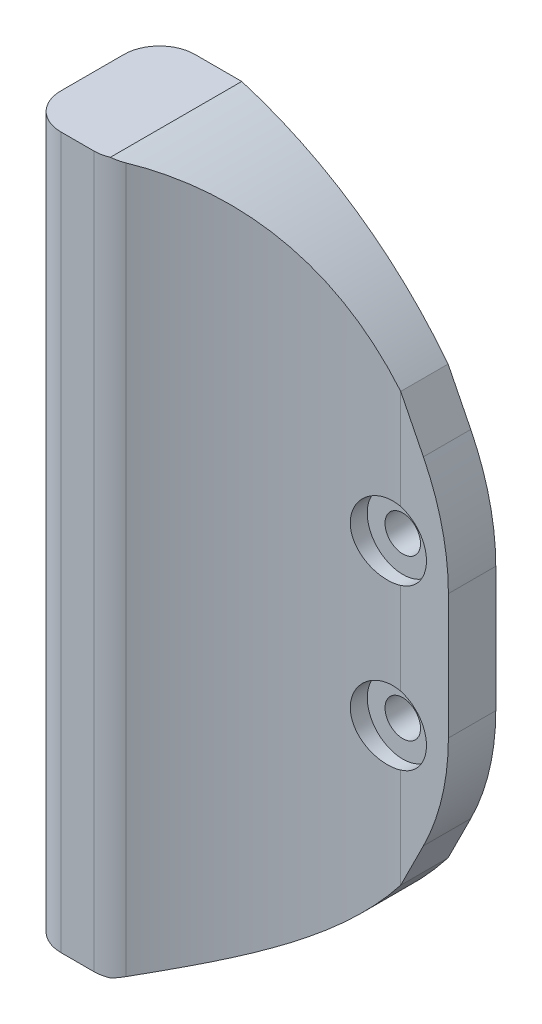
from build123d import *

# Parameters (mm, degrees)
SKETCH_1_W          = 35.317292642
SKETCH_1_H          = 60
SKETCH_1_R          = 1.5
EXTRUDE_1_DEPTH     = 8
SKETCH_2_R          = 3
CUT_EXTRUDE_1_DEPTH = 3
EXTRUDE_2_DEPTH     = 60
FILLET_1_R          = 3
SKETCH_4_R          = 5
CUT_EXTRUDE_2_DEPTH = 47.960729747
CUT_EXTRUDE_3_DEPTH = 10
FILLET_2_R          = 20
CUT_EXTRUDE_4_DEPTH = 71.495063746
CUT_EXTRUDE_5_DEPTH = 2
CUT_EXTRUDE_6_DEPTH = 48.639836404
CUT_EXTRUDE_7_DEPTH = 71.495063746
FILLET_4_R          = 3


with BuildPart() as part:
    # 草图1 → 凸台-拉伸1 (new body)
    with BuildSketch(Plane.XY):
        Rectangle(SKETCH_1_W, SKETCH_1_H)
        with Locations((0, 13.5)):
            Circle(SKETCH_1_R, mode=Mode.SUBTRACT)
        with Locations((11.691342951, 6.75)):
            Circle(SKETCH_1_R, mode=Mode.SUBTRACT)
        with Locations((11.691342951, -6.75)):
            Circle(SKETCH_1_R, mode=Mode.SUBTRACT)
        with Locations((0, -13.5)):
            Circle(SKETCH_1_R, mode=Mode.SUBTRACT)
        with Locations((-11.691342951, -6.75)):
            Circle(SKETCH_1_R, mode=Mode.SUBTRACT)
        with Locations((-11.691342951, 6.75)):
            Circle(SKETCH_1_R, mode=Mode.SUBTRACT)
    extrude(amount=EXTRUDE_1_DEPTH)

    # 草图2 → 切除-拉伸1 (cut)
    with BuildSketch(Plane.XY.offset(8)):
        with Locations((0, 13.5)):
            Circle(SKETCH_2_R)
        with Locations((11.691342951, 6.75)):
            Circle(SKETCH_2_R)
        with Locations((11.691342951, -6.75)):
            Circle(SKETCH_2_R)
        with Locations((0, -13.5)):
            Circle(SKETCH_2_R)
        with Locations((-11.691342951, -6.75)):
            Circle(SKETCH_2_R)
        with Locations((-11.691342951, 6.75)):
            Circle(SKETCH_2_R)
    extrude(amount=-CUT_EXTRUDE_1_DEPTH, mode=Mode.SUBTRACT)

    # 草图3 → 凸台-拉伸2 (add)
    with BuildSketch(Plane.XZ.offset(30)):
        Polygon((-23.303511793, 11.324481191), (-17.658646321, 8), (-17.658646321, 0), (-35.232231527, 0), (-35.232231527, 11.324481191), align=None)
    extrude(amount=-EXTRUDE_2_DEPTH)

    # 圆角1
    fillet_1_edges = [part.edges().sort_by_distance(p)[0] for p in [
        (-17.658646321, 0, 8),
        (-35.232231527, 0, 11.324481191),
        (17.658646321, -30, 4),
        (-35.232231527, 0, 0),
        (-23.303511793, 0, 11.324481191),
        (17.658646321, 30, 4),
    ]]
    fillet(fillet_1_edges, radius=FILLET_1_R)

    # 草图4 → 切除-拉伸2 (cut, through all)
    with BuildSketch(Plane.XY.offset(8)):
        Circle(SKETCH_4_R)
    extrude(amount=-CUT_EXTRUDE_2_DEPTH, mode=Mode.SUBTRACT)

    # 草图5 → 切除-拉伸3 (cut)
    with BuildSketch(Plane.XY.offset(8)):
        with BuildLine():
            ThreePointArc((14.658646321, -30), (16.779966665, -29.121320344), (17.658646321, -27))
            Line((17.658646321, -27), (17.658646321, 27))
            ThreePointArc((17.658646321, 27), (16.779966665, 29.121320344), (14.658646321, 30))
            Line((14.658646321, 30), (-16.840879336, 30))
            Line((-16.840879336, 30), (-6.840879336, 10))
            Line((-6.840879336, 10), (-6.840879336, 0))
            Line((-6.840879336, 0), (-6.840879336, -10))
            Line((-6.840879336, -10), (-16.840879336, -30))
            Line((-16.840879336, -30), (14.658646321, -30))
        make_face()
    extrude(amount=-CUT_EXTRUDE_3_DEPTH, mode=Mode.SUBTRACT)

    # 圆角2
    fillet_2_edges = [part.edges().sort_by_distance(p)[0] for p in [
        (-6.840879336, -10, 4),
        (-6.840879336, 10, 4),
    ]]
    fillet(fillet_2_edges, radius=FILLET_2_R)

    # 草图6 → 切除-拉伸4 (cut, through all)
    with BuildSketch(Plane.XZ.offset(30)):
        with BuildLine():
            Line((-18.363290882, 8.414992633), (-16.840879336, 7.518385164))
            Line((-16.840879336, 7.518385164), (-16.840879336, 8))
            ThreePointArc((-16.840879336, 8), (-17.629859025, 8.105606963), (-18.363290882, 8.414992633))
        make_face()
        Polygon((-16.840879336, 8), (-16.840879336, 7.518385164), (-10.866770961, 4), (-6.840879336, 4), (-6.840879336, 8), (-8.952335516, 8), align=None)
        with BuildLine():
            Line((-28.285671321, 11.324481191), (-16.840879336, 6.512055498))
            Line((-16.840879336, 6.512055498), (-16.840879336, 7.518385164))
            Line((-16.840879336, 7.518385164), (-18.363290882, 8.414992633))
            Line((-18.363290882, 8.414992633), (-22.598867233, 10.909488557))
            ThreePointArc((-22.598867233, 10.909488557), (-23.332299089, 11.218874227), (-24.121278778, 11.324481191))
            Line((-24.121278778, 11.324481191), (-28.285671321, 11.324481191))
        make_face()
        Polygon((-16.840879336, 7.518385164), (-16.840879336, 6.512055498), (-10.866770961, 4), align=None)
    extrude(amount=-CUT_EXTRUDE_4_DEPTH, mode=Mode.SUBTRACT)

    # 草图7 → 切除-拉伸5 (cut)
    with BuildSketch(Plane.XY.offset(5)):
        with BuildLine():
            ThreePointArc((-13.244946275, 9.316382028), (-14.691342951, 6.75), (-13.244946275, 4.183617972))
            Line((-13.244946275, 4.183617972), (-13.244946275, 9.316382028))
        make_face()
        with BuildLine():
            Line((-13.244946275, 9.316382028), (-13.244946275, 4.183617972))
            ThreePointArc((-13.244946275, 4.183617972), (-10.218388433, 4.13649565), (-8.691342951, 6.75))
            ThreePointArc((-8.691342951, 6.75), (-10.218388433, 9.36350435), (-13.244946275, 9.316382028))
        make_face()
        with BuildLine():
            Line((-13.244946275, -9.316382028), (-13.244946275, -4.183617972))
            ThreePointArc((-13.244946275, -4.183617972), (-14.691342951, -6.75), (-13.244946275, -9.316382028))
        make_face()
        with BuildLine():
            ThreePointArc((-13.244946275, -4.183617972), (-14.691342951, -6.75), (-13.244946275, -9.316382028))
            Line((-13.244946275, -9.316382028), (-13.244946275, -4.183617972))
        make_face()
        with BuildLine():
            Line((-13.244946275, -4.183617972), (-13.244946275, -9.316382028))
            ThreePointArc((-13.244946275, -9.316382028), (-10.218388433, -9.36350435), (-8.691342951, -6.75))
            ThreePointArc((-8.691342951, -6.75), (-10.218388433, -4.13649565), (-13.244946275, -4.183617972))
        make_face()
    extrude(amount=-CUT_EXTRUDE_5_DEPTH, mode=Mode.SUBTRACT)

    # 草图8 → 切除-拉伸6 (cut, through all)
    with BuildSketch(Plane.XY.offset(11.324481191)):
        with BuildLine():
            ThreePointArc((-10.866770961, 18.051783249), (-18.640704436, 25.389749731), (-28.285671321, 30))
            Line((-28.285671321, 30), (-16.840879336, 30))
            Line((-16.840879336, 30), (-10.866770961, 18.051783249))
        make_face()
        with BuildLine():
            Line((-16.840879336, -30), (-10.866770961, -18.051783249))
            ThreePointArc((-10.866770961, -18.051783249), (-18.640704436, -25.389749731), (-28.285671321, -30))
            Line((-28.285671321, -30), (-16.840879336, -30))
        make_face()
    extrude(amount=-CUT_EXTRUDE_6_DEPTH, mode=Mode.SUBTRACT)

    # 草图10 → 切除-拉伸7 (cut, through all)
    with BuildSketch(Plane.XZ.offset(30)):
        with BuildLine():
            Line((-10.866770961, 4), (-28.285671321, 11.324481191))
            ThreePointArc((-28.285671321, 11.324481191), (-20.236995628, 6.090803021), (-10.866770961, 4))
        make_face()
    extrude(amount=-CUT_EXTRUDE_7_DEPTH, mode=Mode.SUBTRACT)

    # 圆角4
    fillet_4_edges = [part.edges().sort_by_distance(p)[0] for p in [
        (-28.285671321, 0, 11.324481191),
    ]]
    fillet(fillet_4_edges, radius=FILLET_4_R)


solid = part.part
